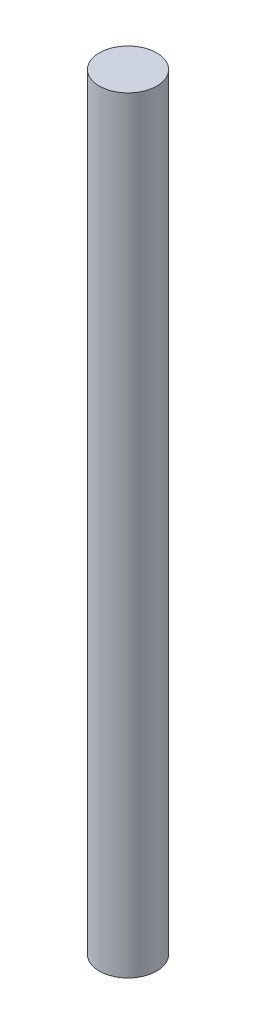
from build123d import *

# Parameters (mm, degrees)
SKETCH_1_W = 1.5
SKETCH_1_H = 40


with BuildPart() as part:
    # 草图1 → 旋转1 (revolve)
    with BuildSketch(Plane.XY.offset(36.94205388), mode=Mode.PRIVATE) as revolve_1_sk:
        with Locations((-32.379294689, 20)):
            Rectangle(SKETCH_1_W, SKETCH_1_H)
    revolve(revolve_1_sk.sketch.rotate(Axis((-33.129294689, 40, 36.94205388), (0, -1, 0)), 270), axis=Axis((-33.129294689, 40, 36.94205388), (0, -1, 0)))


solid = part.part
